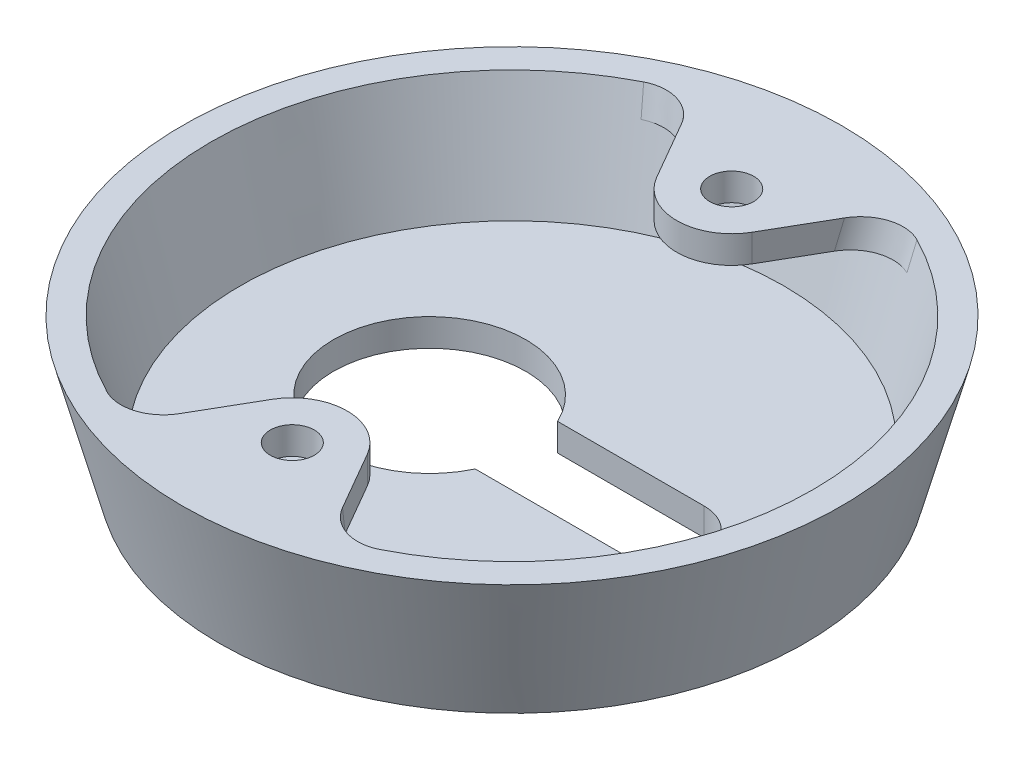
from build123d import *

# Parameters (mm, degrees)
CUT_EXTRUDE_1_REACH = 36.871
SKETCH_3_R          = 1.6
EXTRUDE_1_DEPTH     = 2
FILLET_1_R          = 3


with BuildPart() as part:
    # 草图1 → 旋转1 (revolve)
    with BuildSketch(Plane.XY, mode=Mode.PRIVATE) as revolve_1_sk:
        Polygon((0, 0), (21.320508076, 0), (24, 10), (21.929447639, 10), (19.7858541, 2), (0, 2), align=None)
    revolve(revolve_1_sk.sketch.rotate(Axis((0, 25.167510642, 0), (0, -1, 0)), 90), axis=Axis((0, 25.167510642, 0), (0, -1, 0)))

    # 草图2 → 切除-拉伸1 (cut, up to next)
    with BuildSketch(Plane(origin=(0, 2, 0), x_dir=(1, 0, 0), z_dir=(0, 1, 0)), mode=Mode.PRIVATE) as cut_extrude_1_sk1:
        with BuildLine():
            Line((11, 3), (0.32455532, 3))
            ThreePointArc((0.32455532, 3), (-13, 0), (0.32455532, -3))
            Line((0.32455532, -3), (11, -3))
            ThreePointArc((11, -3), (14, 0), (11, 3))
        make_face()
    cut_extrude_1_tool1 = extrude(cut_extrude_1_sk1.sketch, amount=-CUT_EXTRUDE_1_REACH, mode=Mode.PRIVATE) & part.part
    add(cut_extrude_1_tool1.solids().sort_by_distance((-1.696004, 2, 0))[0], mode=Mode.SUBTRACT)

    # 草图3 → 凸台-拉伸1 (add)
    # profile 1 of 2: a face of its own
    with BuildSketch(Plane(origin=(0, 10, 0), x_dir=(1, 0, 0), z_dir=(0, 1, 0))):
        with BuildLine():
            Line((-3.464101615, 14), (-7.316676114, 20.672854772))
            ThreePointArc((-7.316676114, 20.672854772), (0, 21.929447639), (7.316676114, 20.672854772))
            Line((7.316676114, 20.672854772), (3.464101615, 14))
            ThreePointArc((3.464101615, 14), (0, 12), (-3.464101615, 14))
        make_face()
        with Locations(Location((0, 16, 0), (0, 0, 270))):
            Circle(SKETCH_3_R, mode=Mode.SUBTRACT)
    # profile 2 of 2: a face of its own
    with BuildSketch(Plane(origin=(0, 10, 0), x_dir=(1, 0, 0), z_dir=(0, 1, 0))):
        with BuildLine():
            Line((3.464101615, -14), (7.316676114, -20.672854772))
            ThreePointArc((7.316676114, -20.672854772), (0, -21.929447639), (-7.316676114, -20.672854772))
            Line((-7.316676114, -20.672854772), (-3.464101615, -14))
            ThreePointArc((-3.464101615, -14), (0, -12), (3.464101615, -14))
        make_face()
        with Locations(Location((0, -16, 0), (0, 0, 90))):
            Circle(SKETCH_3_R, mode=Mode.SUBTRACT)
    extrude(amount=-EXTRUDE_1_DEPTH)

    # 圆角1
    fillet_1_edges = [part.edges().sort_by_distance(p)[0] for p in [
        (-7.180384511, 8.99998489, -20.436790791),
        (7.180384511, 8.99998489, -20.436790791),
        (-7.180384511, 8.99998489, 20.436790791),
        (7.180384511, 8.99998489, 20.436790791),
    ]]
    fillet(fillet_1_edges, radius=FILLET_1_R)


solid = part.part
